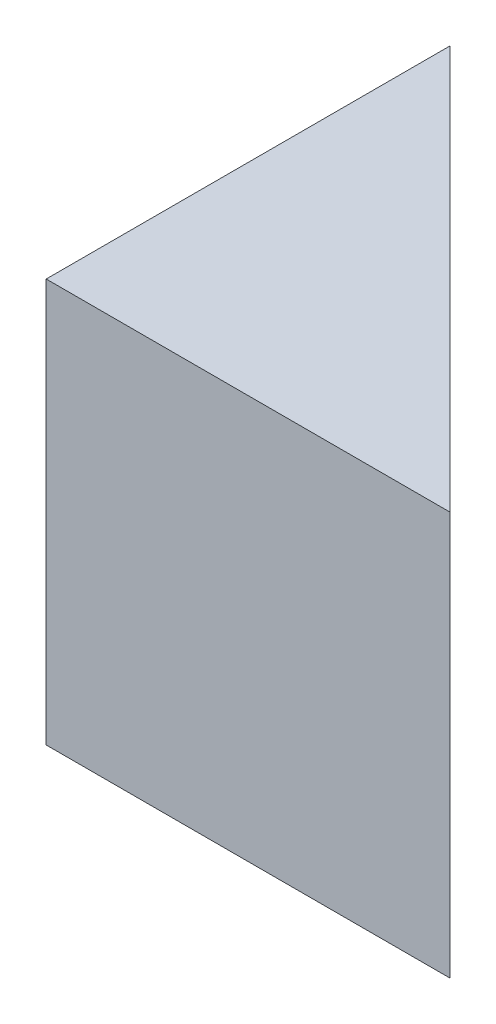
from build123d import *

# Parameters (mm, degrees)
SKETCH_1_W               = 15
SKETCH_1_H               = 15
EXTRUDE_1_DEPTH          = 15
CUT_EXTRUDE_1_DEPTH      = 19.371173071
CUT_EXTRUDE_1_DEPTH_BACK = 19.371173071


with BuildPart() as part:
    # 草图1 → 凸台-拉伸1 (new body)
    with BuildSketch(Plane(origin=(0, 0, 0), x_dir=(1, 0, 0), z_dir=(0, 1, 0))):
        Rectangle(SKETCH_1_W, SKETCH_1_H)
    extrude(amount=EXTRUDE_1_DEPTH)

    # 草图2 → 切除-拉伸1 (cut, two sides: drawn at the far end of the back side and taken through both)
    with BuildSketch(Plane(origin=(0, 15, 0), x_dir=(1, 0, 0), z_dir=(0, 1, 0)).offset(-CUT_EXTRUDE_1_DEPTH_BACK)):
        Polygon((-7.5, 7.5), (7.5, -7.5), (7.5, 7.5), align=None)
    extrude(amount=CUT_EXTRUDE_1_DEPTH + CUT_EXTRUDE_1_DEPTH_BACK, mode=Mode.SUBTRACT)


solid = part.part
